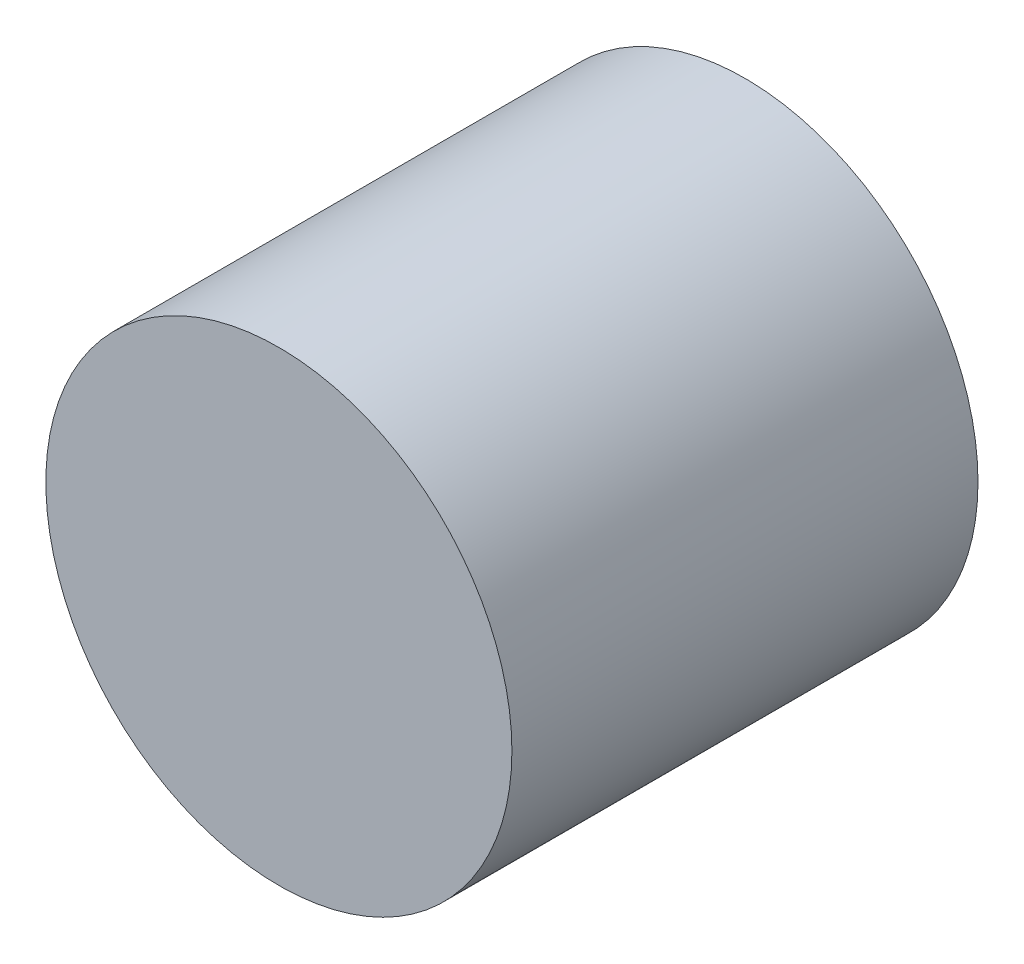
from build123d import *

# Parameters (mm, degrees)
SKETCH1_W = 4
SKETCH1_H = 2


with BuildPart() as part:
    # Sketch1 → Revolve1 (revolve)
    with BuildSketch(Plane(origin=(0, 0, 0), x_dir=(0, 0, -1), z_dir=(1, 0, 0)), mode=Mode.PRIVATE) as revolve1_sk:
        with Locations((2, 1)):
            Rectangle(SKETCH1_W, SKETCH1_H)
    revolve(revolve1_sk.sketch.rotate(Axis((0, 0, 0), (0, 0, -1)), 90), axis=Axis((0, 0, 0), (0, 0, -1)))


solid = part.part
